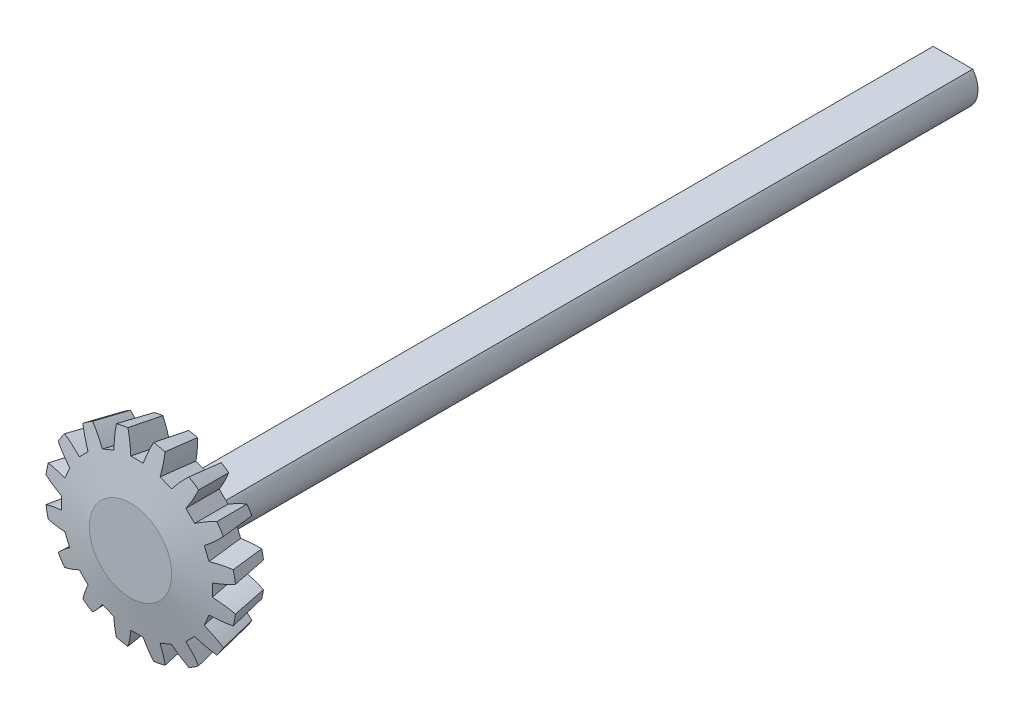
from build123d import *

# Parameters (mm, degrees)
CUT_EXTRUDE1_DEPTH  = 21.72734614
CIRPATTERN1_COUNT   = 16
BOSS_EXTRUDE2_START = -4.412612
BOSS_EXTRUDE2_DEPTH = 80


with BuildPart() as part:
    # Sketch2 → Revolve1 (revolve)
    with BuildSketch(Plane(origin=(0, 0, 0), x_dir=(0, 0, -1), z_dir=(1, 0, 0))):
        Polygon((0, 0), (0, 4), (1, 9.299998774), (4.412612001, 8.617472191), (4.412612001, 0), align=None)
    revolve(axis=Axis((0, 0, -4.412612001), (0, 0, 1)))

    # Sketch6 → Cut-Extrude1 (cut, through all)
    with BuildSketch(Plane(origin=(0, 8.421354901, -5.393192445), x_dir=(-1, 0, 0), z_dir=(0, -0.19611729080207105, -0.9805804445574345))):
        with BuildLine():
            Line((-0.6, -2), (0.6, -2))
            ThreePointArc((0.6, -2), (1.069979771, -0.514520871), (1.75, 0.887299986))
            ThreePointArc((1.75, 0.887299986), (0, 1.049875288), (-1.75, 0.887299986))
            ThreePointArc((-1.75, 0.887299986), (-1.069979771, -0.514520871), (-0.6, -2))
        make_face()
    cut_extrude1 = extrude(amount=-CUT_EXTRUDE1_DEPTH, mode=Mode.SUBTRACT)

    # CirPattern1: Cut-Extrude1 ×16 about axis
    cirpattern1_axis = Axis((0, 0, 0), (0, 0, 1))
    for i in range(1, CIRPATTERN1_COUNT):
        add(cut_extrude1.rotate(cirpattern1_axis, i * 360 / CIRPATTERN1_COUNT), mode=Mode.SUBTRACT)

    # Sketch7 → Boss-Extrude2 (add)
    with BuildSketch(Plane(origin=(0, 0, -4.412612001), x_dir=(-1, 0, 0), z_dir=(0, 0, -1)).offset(BOSS_EXTRUDE2_START)):
        with BuildLine():
            Line((-1.92003444, 1.5), (1.92003444, 1.5))
            ThreePointArc((1.92003444, 1.5), (0, -2.4365), (-1.92003444, 1.5))
        make_face()
    extrude(amount=BOSS_EXTRUDE2_DEPTH)


solid = part.part
